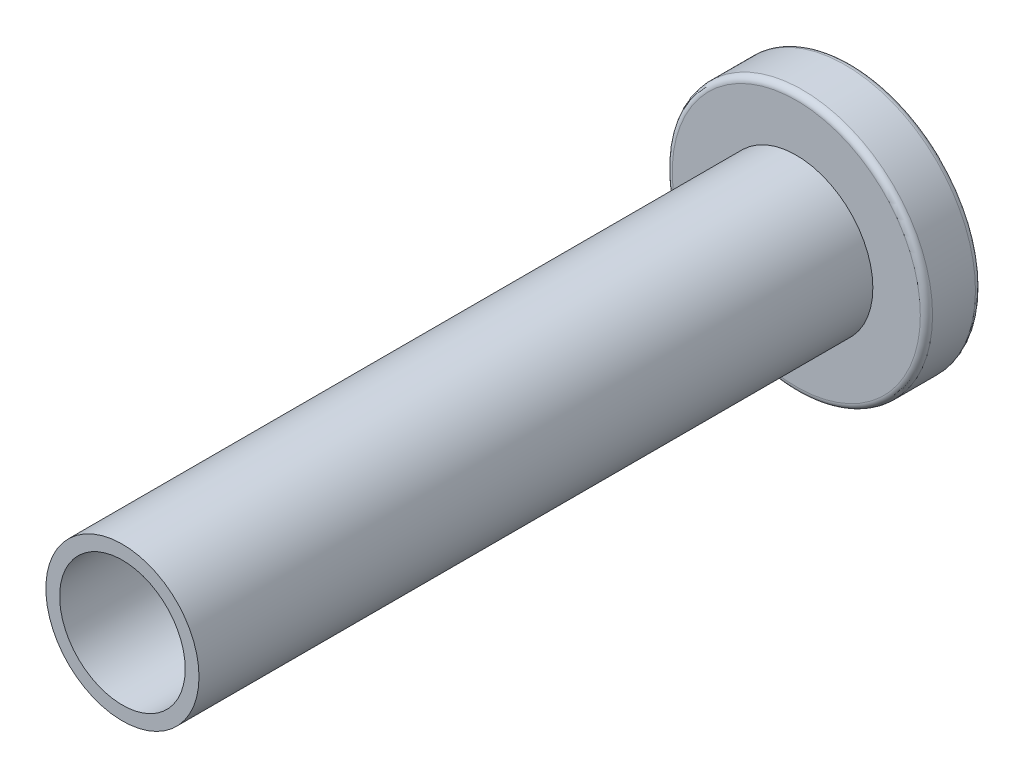
from build123d import *

# Parameters (mm, degrees)
SKETCH_1_R          = 4.25
EXTRUDE_1_DEPTH     = 1.8
SKETCH_2_R          = 2.5
SKETCH_2_R_2        = 2.05
EXTRUDE_2_DEPTH     = 22
FILLET_1_R          = 0.2
CUT_EXTRUDE_1_DEPTH = 1.5


with BuildPart() as part:
    # 草图1 → 凸台-拉伸1 (new body)
    with BuildSketch(Plane.XY):
        Circle(SKETCH_1_R)
    extrude(amount=EXTRUDE_1_DEPTH)

    # 草图2 → 凸台-拉伸2 (add)
    with BuildSketch(Plane.XY.offset(1.8)):
        Circle(SKETCH_2_R)
        Circle(SKETCH_2_R_2, mode=Mode.SUBTRACT)
    extrude(amount=EXTRUDE_2_DEPTH)

    # 圆角1
    fillet_1_edges = [part.edges().sort_by_distance(p)[0] for p in [
        (-4.25, 0, 0),
        (-4.25, 0, 1.8),
    ]]
    fillet(fillet_1_edges, radius=FILLET_1_R)

    # 草图3 → 切除-拉伸1 (cut)
    with BuildSketch(Plane(origin=(0, 0, 0), x_dir=(-1, 0, 0), z_dir=(0, 0, -1))):
        Polygon((1.443375673, 0), (0.721687836, 1.25), (-0.721687836, 1.25), (-1.443375673, 0), (-0.721687836, -1.25), (0.721687836, -1.25), align=None)
    extrude(amount=-CUT_EXTRUDE_1_DEPTH, mode=Mode.SUBTRACT)


solid = part.part
